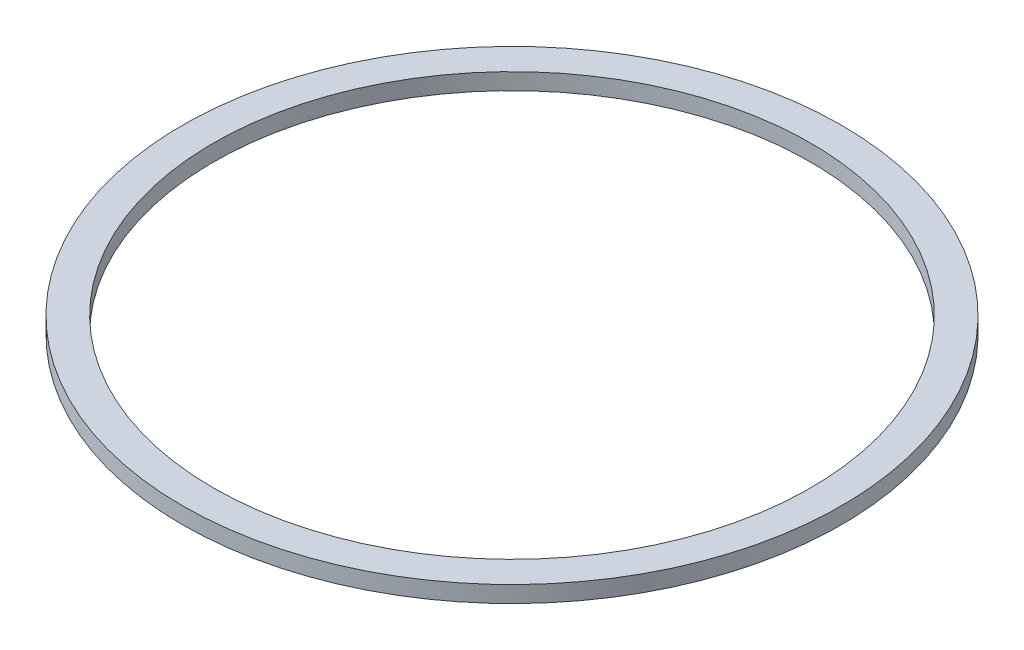
from build123d import *

# Parameters (mm, degrees)
SKETCH1_R           = 80
SKETCH1_R_2         = 72.5
BOSS_EXTRUDE1_DEPTH = 4


with BuildPart() as part:
    # Sketch1 → Boss-Extrude1 (new body)
    with BuildSketch(Plane(origin=(0, 0, 0), x_dir=(1, 0, 0), z_dir=(0, 1, 0))):
        with Locations(Location((0, 0, 0), (0, 0, 270))):
            Circle(SKETCH1_R)
        with Locations(Location((0, 0, 0), (0, 0, 270))):
            Circle(SKETCH1_R_2, mode=Mode.SUBTRACT)
    extrude(amount=BOSS_EXTRUDE1_DEPTH)


solid = part.part
